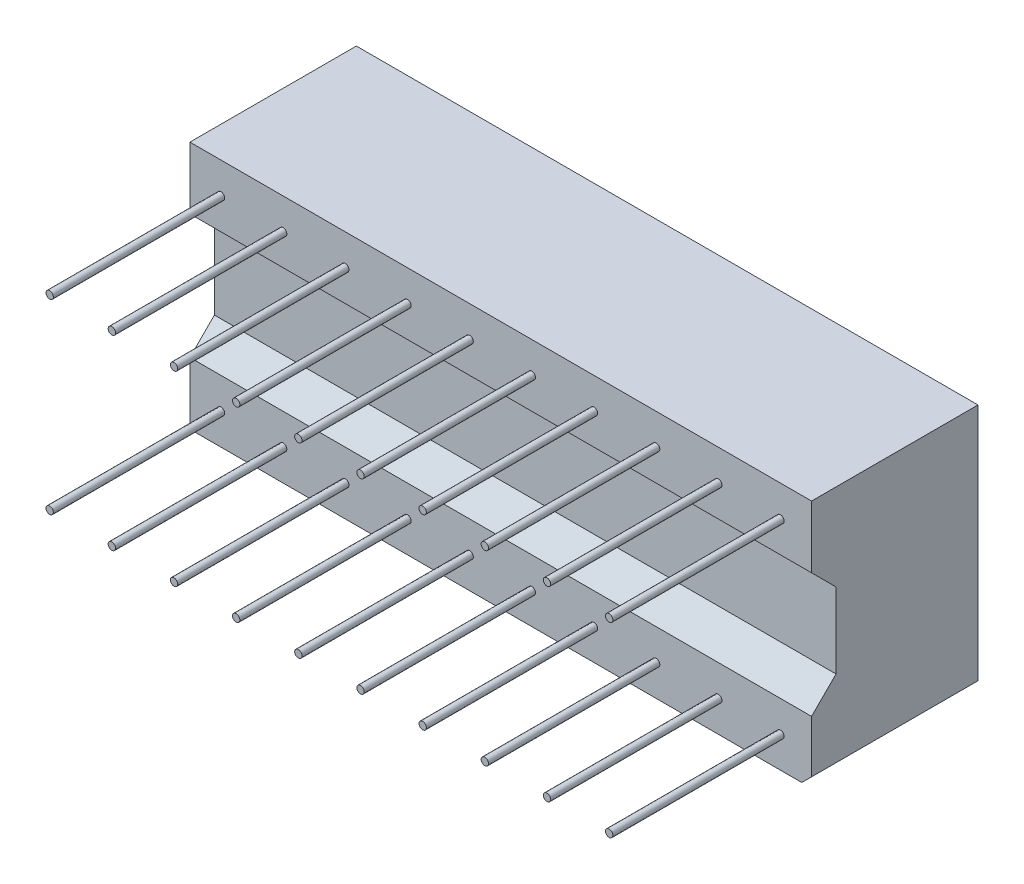
from build123d import *

# Parameters (mm, degrees)
SKETCH1_W              = 25.4
SKETCH1_H              = 10.16
BOSS_EXTRUDE1_DEPTH    = 6.8
CUT_EXTRUDE1_DEPTH     = 27.780709475
SKETCH3_R              = 0.15
BOSS_EXTRUDE2_DEPTH    = 7
BOSS_EXTRUDE2_2_DEPTH  = 7
BOSS_EXTRUDE2_3_DEPTH  = 7
BOSS_EXTRUDE2_4_DEPTH  = 7
BOSS_EXTRUDE2_5_DEPTH  = 7
BOSS_EXTRUDE2_6_DEPTH  = 7
BOSS_EXTRUDE2_7_DEPTH  = 7
BOSS_EXTRUDE2_8_DEPTH  = 7
BOSS_EXTRUDE2_9_DEPTH  = 7
BOSS_EXTRUDE2_10_DEPTH = 7
BOSS_EXTRUDE2_11_DEPTH = 7
BOSS_EXTRUDE2_12_DEPTH = 7
BOSS_EXTRUDE2_13_DEPTH = 7
BOSS_EXTRUDE2_14_DEPTH = 7
BOSS_EXTRUDE2_15_DEPTH = 7
BOSS_EXTRUDE2_16_DEPTH = 7
BOSS_EXTRUDE2_17_DEPTH = 7
BOSS_EXTRUDE2_18_DEPTH = 7
BOSS_EXTRUDE2_19_DEPTH = 7
BOSS_EXTRUDE2_20_DEPTH = 7
SKETCH4_W              = 1.74
SKETCH4_H              = 5
CUT_EXTRUDE2_DEPTH     = 0.1
CHAMFER1_SIZE          = 0.4


with BuildPart() as part:
    # Sketch1 → Boss-Extrude1 (new body)
    with BuildSketch(Plane.XY):
        Rectangle(SKETCH1_W, SKETCH1_H)
    extrude(amount=-BOSS_EXTRUDE1_DEPTH)

    # Sketch2 → Cut-Extrude1 (cut, through all)
    with BuildSketch(Plane.ZY.offset(12.7)):
        Polygon((0, -2.54), (0, 2.54), (-1, 1.54), (-1, -1.54), align=None)
    extrude(amount=-CUT_EXTRUDE1_DEPTH, mode=Mode.SUBTRACT)

    # Sketch4 → Cut-Extrude2 (cut)
    with BuildSketch(Plane(origin=(0, 0, -6.8), x_dir=(-1, 0, 0), z_dir=(0, 0, -1))):
        with Locations((11.43, 0)):
            Rectangle(SKETCH4_W, SKETCH4_H)
        with Locations((8.89, 0)):
            Rectangle(SKETCH4_W, SKETCH4_H)
        with Locations((6.35, 0)):
            Rectangle(SKETCH4_W, SKETCH4_H)
        with Locations((3.81, 0)):
            Rectangle(SKETCH4_W, SKETCH4_H)
        with Locations((1.27, 0)):
            Rectangle(SKETCH4_W, SKETCH4_H)
        with Locations((-1.27, 0)):
            Rectangle(SKETCH4_W, SKETCH4_H)
        with Locations((-3.81, 0)):
            Rectangle(SKETCH4_W, SKETCH4_H)
        with Locations((-6.35, 0)):
            Rectangle(SKETCH4_W, SKETCH4_H)
        with Locations((-8.89, 0)):
            Rectangle(SKETCH4_W, SKETCH4_H)
        with Locations((-11.43, 0)):
            Rectangle(SKETCH4_W, SKETCH4_H)
    extrude(amount=-CUT_EXTRUDE2_DEPTH, mode=Mode.SUBTRACT)

    # Chamfer1
    chamfer1_edges = [part.edges().sort_by_distance(p)[0] for p in [
        (12.7, -5.08, -3.4),
    ]]
    chamfer(chamfer1_edges, length=CHAMFER1_SIZE)


with BuildPart() as body_2:
    # Sketch3 → Boss-Extrude2 (new body)
    with BuildSketch(Plane.XY):
        with Locations((11.43, 3.81)):
            Circle(SKETCH3_R)
    extrude(amount=BOSS_EXTRUDE2_DEPTH)


with BuildPart() as body_3:
    # Sketch3 → Boss-Extrude2 2 (new body)
    with BuildSketch(Plane.XY):
        with Locations((8.89, 3.81)):
            Circle(SKETCH3_R)
    extrude(amount=BOSS_EXTRUDE2_2_DEPTH)


with BuildPart() as body_4:
    # Sketch3 → Boss-Extrude2 3 (new body)
    with BuildSketch(Plane.XY):
        with Locations((6.35, 3.81)):
            Circle(SKETCH3_R)
    extrude(amount=BOSS_EXTRUDE2_3_DEPTH)


with BuildPart() as body_5:
    # Sketch3 → Boss-Extrude2 4 (new body)
    with BuildSketch(Plane.XY):
        with Locations((3.81, 3.81)):
            Circle(SKETCH3_R)
    extrude(amount=BOSS_EXTRUDE2_4_DEPTH)


with BuildPart() as body_6:
    # Sketch3 → Boss-Extrude2 5 (new body)
    with BuildSketch(Plane.XY):
        with Locations((1.27, 3.81)):
            Circle(SKETCH3_R)
    extrude(amount=BOSS_EXTRUDE2_5_DEPTH)


with BuildPart() as body_7:
    # Sketch3 → Boss-Extrude2 6 (new body)
    with BuildSketch(Plane.XY):
        with Locations((-1.27, 3.81)):
            Circle(SKETCH3_R)
    extrude(amount=BOSS_EXTRUDE2_6_DEPTH)


with BuildPart() as body_8:
    # Sketch3 → Boss-Extrude2 7 (new body)
    with BuildSketch(Plane.XY):
        with Locations((-3.81, 3.81)):
            Circle(SKETCH3_R)
    extrude(amount=BOSS_EXTRUDE2_7_DEPTH)


with BuildPart() as body_9:
    # Sketch3 → Boss-Extrude2 8 (new body)
    with BuildSketch(Plane.XY):
        with Locations((-6.35, 3.81)):
            Circle(SKETCH3_R)
    extrude(amount=BOSS_EXTRUDE2_8_DEPTH)


with BuildPart() as body_10:
    # Sketch3 → Boss-Extrude2 9 (new body)
    with BuildSketch(Plane.XY):
        with Locations((-8.89, 3.81)):
            Circle(SKETCH3_R)
    extrude(amount=BOSS_EXTRUDE2_9_DEPTH)


with BuildPart() as body_11:
    # Sketch3 → Boss-Extrude2 10 (new body)
    with BuildSketch(Plane.XY):
        with Locations((-11.43, 3.81)):
            Circle(SKETCH3_R)
    extrude(amount=BOSS_EXTRUDE2_10_DEPTH)


with BuildPart() as body_12:
    # Sketch3 → Boss-Extrude2 11 (new body)
    with BuildSketch(Plane.XY):
        with Locations(Location((-11.43, -3.81, 0), (0, 0, 180))):
            Circle(SKETCH3_R)
    extrude(amount=BOSS_EXTRUDE2_11_DEPTH)


with BuildPart() as body_13:
    # Sketch3 → Boss-Extrude2 12 (new body)
    with BuildSketch(Plane.XY):
        with Locations(Location((-8.89, -3.81, 0), (0, 0, 180))):
            Circle(SKETCH3_R)
    extrude(amount=BOSS_EXTRUDE2_12_DEPTH)


with BuildPart() as body_14:
    # Sketch3 → Boss-Extrude2 13 (new body)
    with BuildSketch(Plane.XY):
        with Locations(Location((-6.35, -3.81, 0), (0, 0, 180))):
            Circle(SKETCH3_R)
    extrude(amount=BOSS_EXTRUDE2_13_DEPTH)


with BuildPart() as body_15:
    # Sketch3 → Boss-Extrude2 14 (new body)
    with BuildSketch(Plane.XY):
        with Locations(Location((-3.81, -3.81, 0), (0, 0, 180))):
            Circle(SKETCH3_R)
    extrude(amount=BOSS_EXTRUDE2_14_DEPTH)


with BuildPart() as body_16:
    # Sketch3 → Boss-Extrude2 15 (new body)
    with BuildSketch(Plane.XY):
        with Locations(Location((-1.27, -3.81, 0), (0, 0, 180))):
            Circle(SKETCH3_R)
    extrude(amount=BOSS_EXTRUDE2_15_DEPTH)


with BuildPart() as body_17:
    # Sketch3 → Boss-Extrude2 16 (new body)
    with BuildSketch(Plane.XY):
        with Locations(Location((1.27, -3.81, 0), (0, 0, 180))):
            Circle(SKETCH3_R)
    extrude(amount=BOSS_EXTRUDE2_16_DEPTH)


with BuildPart() as body_18:
    # Sketch3 → Boss-Extrude2 17 (new body)
    with BuildSketch(Plane.XY):
        with Locations(Location((3.81, -3.81, 0), (0, 0, 180))):
            Circle(SKETCH3_R)
    extrude(amount=BOSS_EXTRUDE2_17_DEPTH)


with BuildPart() as body_19:
    # Sketch3 → Boss-Extrude2 18 (new body)
    with BuildSketch(Plane.XY):
        with Locations(Location((6.35, -3.81, 0), (0, 0, 180))):
            Circle(SKETCH3_R)
    extrude(amount=BOSS_EXTRUDE2_18_DEPTH)


with BuildPart() as body_20:
    # Sketch3 → Boss-Extrude2 19 (new body)
    with BuildSketch(Plane.XY):
        with Locations(Location((8.89, -3.81, 0), (0, 0, 180))):
            Circle(SKETCH3_R)
    extrude(amount=BOSS_EXTRUDE2_19_DEPTH)


with BuildPart() as body_21:
    # Sketch3 → Boss-Extrude2 20 (new body)
    with BuildSketch(Plane.XY):
        with Locations(Location((11.43, -3.81, 0), (0, 0, 180))):
            Circle(SKETCH3_R)
    extrude(amount=BOSS_EXTRUDE2_20_DEPTH)


solid = Compound([part.part, body_2.part, body_3.part, body_4.part, body_5.part, body_6.part, body_7.part, body_8.part, body_9.part, body_10.part, body_11.part, body_12.part, body_13.part, body_14.part, body_15.part, body_16.part, body_17.part, body_18.part, body_19.part, body_20.part, body_21.part])
